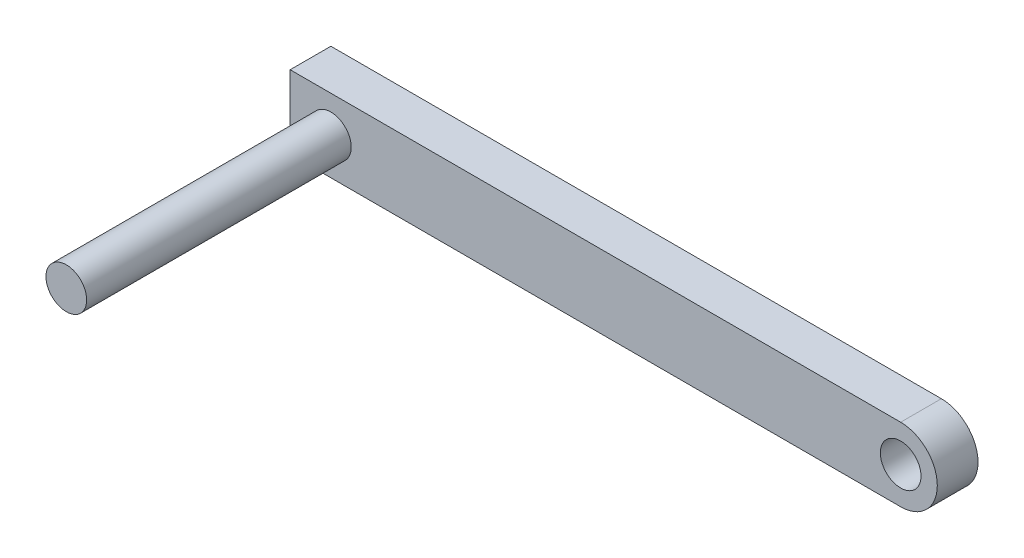
from build123d import *

# Parameters (mm, degrees)
ESQUISSE1_R        = 10
BOSS_EXTRU_1_DEPTH = 20
ESQUISSE2_R        = 10
BOSS_EXTRU_2_DEPTH = 130


with BuildPart() as part:
    # Esquisse1 → Boss.-Extru.1 (new body)
    with BuildSketch(Plane.XY):
        with BuildLine():
            Line((0, 0), (300, 0))
            ThreePointArc((300, 0), (318, 18), (300, 36))
            Line((300, 36), (0, 36))
            Line((0, 36), (0, 0))
        make_face()
        with Locations((300, 18)):
            Circle(ESQUISSE1_R, mode=Mode.SUBTRACT)
    extrude(amount=BOSS_EXTRU_1_DEPTH)

    # Esquisse2 → Boss.-Extru.2 (add)
    with BuildSketch(Plane.XY.offset(20)):
        with Locations((20, 18)):
            Circle(ESQUISSE2_R)
    extrude(amount=BOSS_EXTRU_2_DEPTH)


solid = part.part
